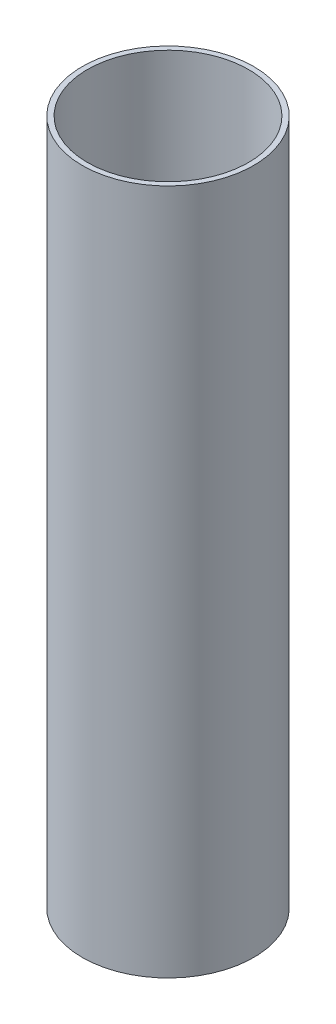
from build123d import *

# Parameters (mm, degrees)
SKETCH_1_R      = 25
SKETCH_1_R_2    = 23.5
EXTRUDE_1_DEPTH = 200


with BuildPart() as part:
    # 草图1 → 凸台-拉伸1 (new body)
    with BuildSketch(Plane(origin=(0, 0, 0), x_dir=(1, 0, 0), z_dir=(0, 1, 0))):
        with Locations(Location((0, 0, 0), (0, 0, 270))):
            Circle(SKETCH_1_R)
        with Locations(Location((0, 0, 0), (0, 0, 270))):
            Circle(SKETCH_1_R_2, mode=Mode.SUBTRACT)
    extrude(amount=EXTRUDE_1_DEPTH)


solid = part.part
